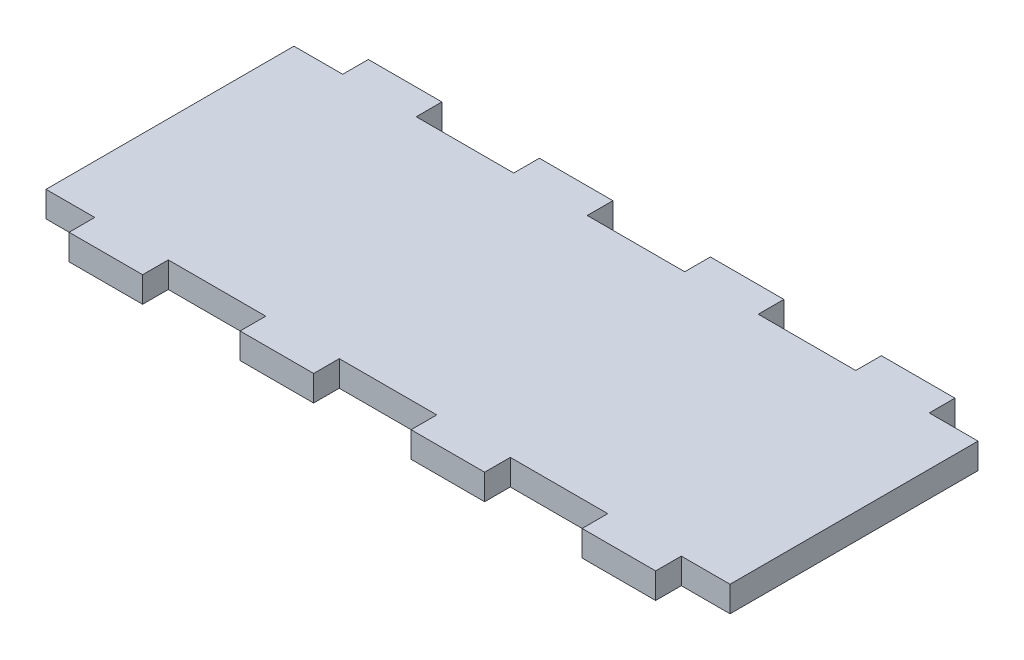
from build123d import *

# Parameters (mm, degrees)
BOSS_EXTRU_1_DEPTH = 3


with BuildPart() as part:
    # Esquisse1 → Boss.-Extru.1 (new body)
    with BuildSketch(Plane(origin=(0, 0, 0), x_dir=(1, 0, 0), z_dir=(0, 1, 0))):
        Polygon((25.7, 3), (25.7, 0), (34.3, 0), (34.3, 3), (45.7, 3), (45.7, 0), (54.3, 0), (54.3, 3), (65.7, 3), (65.7, 0), (74.3, 0), (74.3, 3), (80, 3), (80, 32), (74.3, 32), (74.3, 35), (65.7, 35), (65.7, 32), (54.3, 32), (54.3, 35), (45.7, 35), (45.7, 32), (34.3, 32), (34.3, 35), (25.7, 35), (25.7, 32), (14.3, 32), (14.3, 35), (5.7, 35), (5.7, 32), (0, 32), (0, 3), (5.7, 3), (5.7, 0), (14.3, 0), (14.3, 3), align=None)
    extrude(amount=BOSS_EXTRU_1_DEPTH)


solid = part.part
